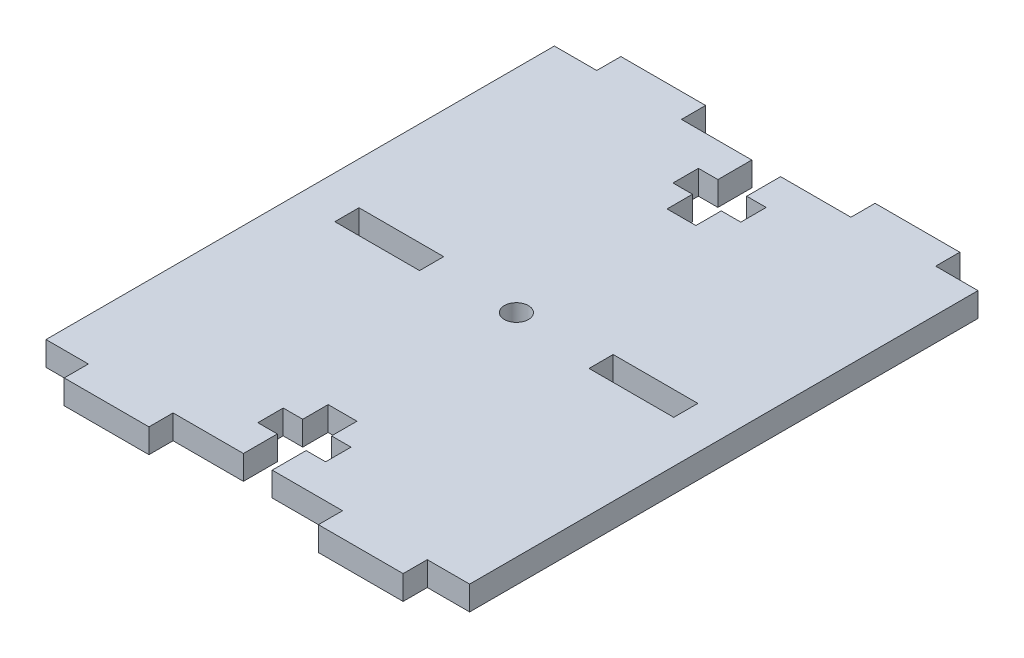
from build123d import *

# Parameters (mm, degrees)
SKETCH1_W           = 50
SKETCH1_H           = 60
BOSS_EXTRUDE1_DEPTH = 2.85
SKETCH2_W           = 10
SKETCH2_H           = 2.85
BOSS_EXTRUDE2_DEPTH = 2.85
CUT_EXTRUDE1_DEPTH  = 42.379282256
SKETCH4_R           = 1.425
SKETCH4_W           = 10
SKETCH4_H           = 2.85
CUT_EXTRUDE2_DEPTH  = 42.379282256


with BuildPart() as part:
    # Sketch1 → Boss-Extrude1 (new body)
    with BuildSketch(Plane(origin=(0, 0, 0), x_dir=(1, 0, 0), z_dir=(0, 1, 0))):
        Rectangle(SKETCH1_W, SKETCH1_H)
    extrude(amount=BOSS_EXTRUDE1_DEPTH)

    # Sketch2 → Boss-Extrude2 (add)
    with BuildSketch(Plane(origin=(0, 2.85, 0), x_dir=(1, 0, 0), z_dir=(0, 1, 0))):
        with Locations((-15, 31.425)):
            Rectangle(SKETCH2_W, SKETCH2_H)
        with Locations((15, 31.425)):
            Rectangle(SKETCH2_W, SKETCH2_H)
    boss_extrude2 = extrude(amount=-BOSS_EXTRUDE2_DEPTH)

    # Sketch3 → Cut-Extrude1 (cut, through all)
    with BuildSketch(Plane(origin=(0, 2.85, 0), x_dir=(1, 0, 0), z_dir=(0, 1, 0))):
        Polygon((-4, 26), (-1.7, 26), (-1.7, 30), (1.7, 30), (1.7, 26), (4, 26), (4, 23), (1.7, 23), (1.7, 20), (-1.7, 20), (-1.7, 23), (-4, 23), align=None)
    cut_extrude1 = extrude(amount=-CUT_EXTRUDE1_DEPTH, mode=Mode.SUBTRACT)

    # Mirror1: Boss-Extrude2, Cut-Extrude1 across plane
    add(boss_extrude2.mirror(Plane.XY))
    add(cut_extrude1.mirror(Plane.XY), mode=Mode.SUBTRACT)

    # Sketch4 → Cut-Extrude2 (cut, through all)
    with BuildSketch(Plane(origin=(0, 2.85, 0), x_dir=(1, 0, 0), z_dir=(0, 1, 0))):
        with Locations(Location((0, 0.515, 0), (0, 0, 270))):
            Circle(SKETCH4_R)
        with Locations((-15, 0.515)):
            Rectangle(SKETCH4_W, SKETCH4_H)
        with Locations((15, 0.515)):
            Rectangle(SKETCH4_W, SKETCH4_H)
    extrude(amount=-CUT_EXTRUDE2_DEPTH, mode=Mode.SUBTRACT)


solid = part.part
